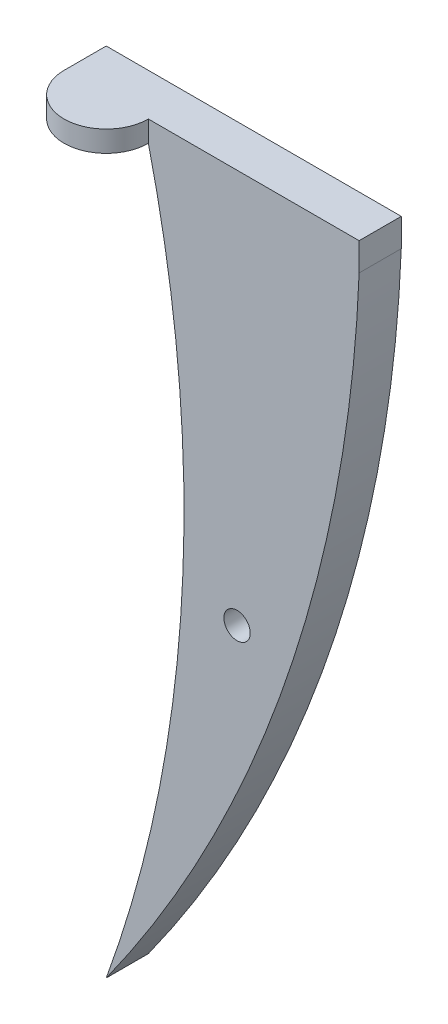
from build123d import *

# Parameters (mm, degrees)
SKETCH1_W           = 35.56
SKETCH1_H           = 5.08
BOSS_EXTRUDE1_DEPTH = 92.202
SKETCH4_W           = 10.16
SKETCH4_H           = 2.54
BOSS_EXTRUDE4_DEPTH = 5.08
CUT_EXTRUDE1_DEPTH  = 2.54
CUT_EXTRUDE3_DEPTH  = 95.037990217
SKETCH11_R          = 1.5875
CUT_EXTRUDE5_DEPTH  = 95.037990217


with BuildPart() as part:
    # Sketch1 → Boss-Extrude1 (new body)
    with BuildSketch(Plane(origin=(0, 0, 0), x_dir=(1, 0, 0), z_dir=(0, 1, 0))):
        Rectangle(SKETCH1_W, SKETCH1_H)
    extrude(amount=BOSS_EXTRUDE1_DEPTH)

    # Sketch4 → Boss-Extrude4 (add)
    with BuildSketch(Plane.XY.offset(2.54)):
        with Locations((-12.7, 90.932)):
            Rectangle(SKETCH4_W, SKETCH4_H)
    extrude(amount=BOSS_EXTRUDE4_DEPTH)

    # Sketch5 → Cut-Extrude1 (cut)
    with BuildSketch(Plane(origin=(0, 92.202, 0), x_dir=(1, 0, 0), z_dir=(0, 1, 0))):
        with BuildLine():
            ThreePointArc((-12.7, -7.62), (-16.292102448, -6.132102448), (-17.78, -2.54))
            Line((-17.78, -2.54), (-17.78, -7.62))
            Line((-17.78, -7.62), (-12.7, -7.62))
        make_face()
        with BuildLine():
            Line((-7.62, -7.62), (-7.62, -2.54))
            ThreePointArc((-7.62, -2.54), (-9.107897552, -6.132102448), (-12.7, -7.62))
            Line((-12.7, -7.62), (-7.62, -7.62))
        make_face()
    extrude(amount=-CUT_EXTRUDE1_DEPTH, mode=Mode.SUBTRACT)

    # Sketch7 → Cut-Extrude3 (cut, through all)
    with BuildSketch(Plane.XY.offset(2.54)):
        with BuildLine():
            ThreePointArc((-12.7, 0), (-3.575035086, 44.457914169), (-7.62, 89.662))
            Line((-7.62, 89.662), (-17.78, 89.662))
            Line((-17.78, 89.662), (-17.78, 0))
            Line((-17.78, 0), (-12.7, 0))
        make_face()
        with BuildLine():
            ThreePointArc((17.78, 88.831864431), (9.052257411, 42.18144567), (-12.7, 0))
            Line((-12.7, 0), (17.78, 0))
            Line((17.78, 0), (17.78, 88.831864431))
        make_face()
    extrude(amount=-CUT_EXTRUDE3_DEPTH, mode=Mode.SUBTRACT)

    # Sketch11 → Cut-Extrude5 (cut, through all)
    with BuildSketch(Plane.XY.offset(2.54)):
        with Locations((3.069944239, 44.6786)):
            Circle(SKETCH11_R)
    extrude(amount=-CUT_EXTRUDE5_DEPTH, mode=Mode.SUBTRACT)


solid = part.part
